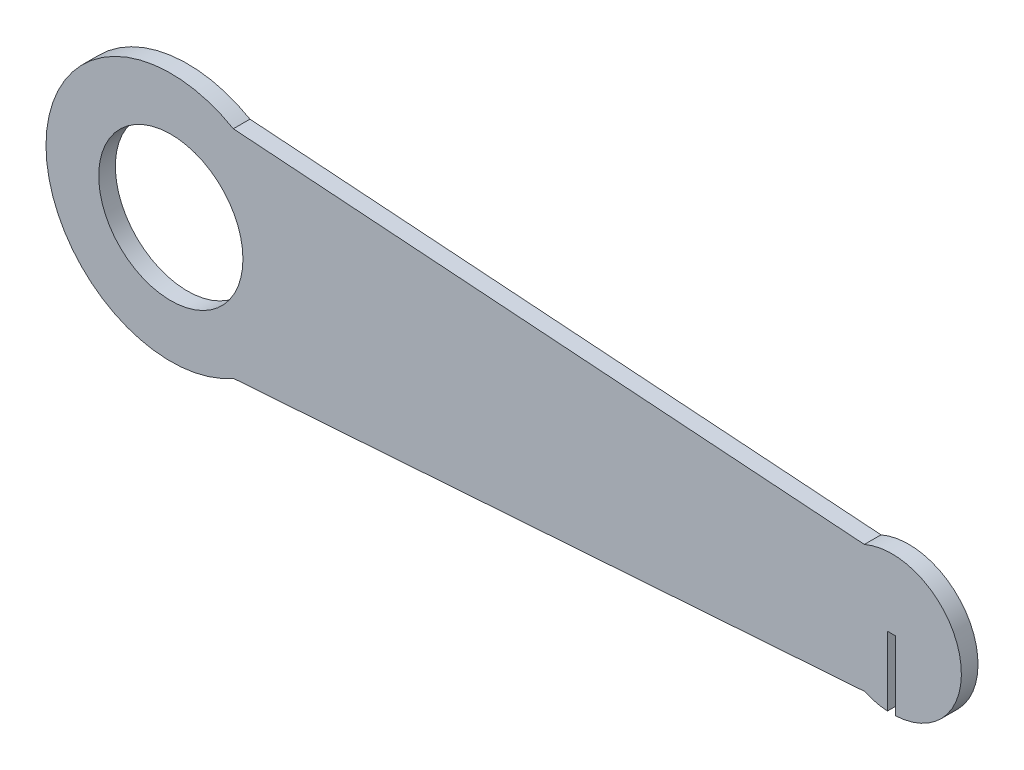
from build123d import *

# Parameters (mm, degrees)
SKETCH1_R           = 13
BOSS_EXTRUDE1_DEPTH = 3


with BuildPart() as part:
    # Sketch1 → Boss-Extrude1 (new body)
    with BuildSketch(Plane.XY):
        with BuildLine():
            Line((125.012278301, 11.461790098), (11.264435627, 19.47723004))
            ThreePointArc((11.264435627, 19.47723004), (-22.5, 0), (11.264435627, -19.47723004))
            Line((11.264435627, -19.47723004), (125.012278301, -11.461790098))
            ThreePointArc((125.012278301, -11.461790098), (127.047433933, -12.146289706), (129.169709598, -12.472394231))
            Line((129.169709598, -12.472394231), (129.169709598, 0))
            Line((129.169709598, 0), (130.669709598, 0))
            Line((130.669709598, 0), (130.669709598, -12.482046669))
            ThreePointArc((130.669709598, -12.482046669), (142.165037481, 2.87434568), (125.012278301, 11.461790098))
        make_face()
        Circle(SKETCH1_R, mode=Mode.SUBTRACT)
    extrude(amount=BOSS_EXTRUDE1_DEPTH)


solid = part.part
